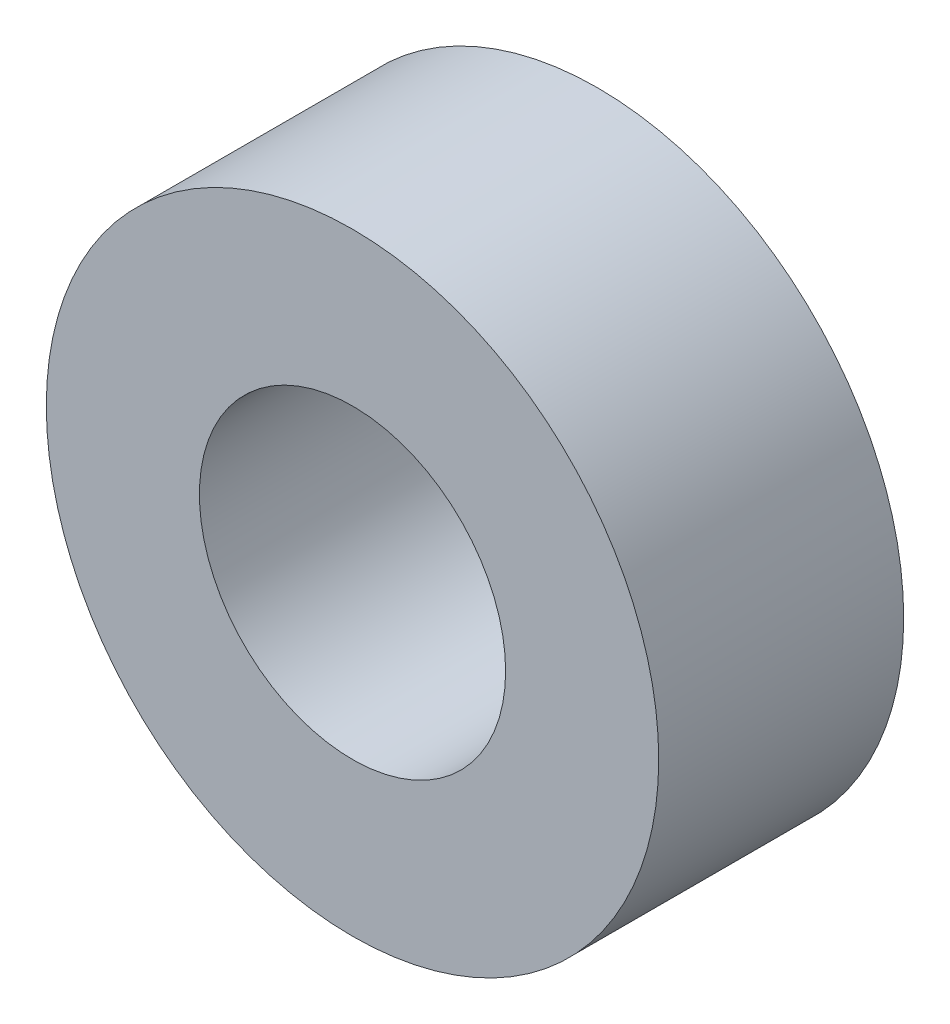
from build123d import *

# Parameters (mm, degrees)
SKETCH1_R           = 5
SKETCH1_R_2         = 2.5
BOSS_EXTRUDE1_DEPTH = 2


with BuildPart() as part:
    # Sketch1 → Boss-Extrude1 (new, symmetric)
    with BuildSketch(Plane.XY):
        Circle(SKETCH1_R)
        Circle(SKETCH1_R_2, mode=Mode.SUBTRACT)
    extrude(amount=BOSS_EXTRUDE1_DEPTH, both=True)


solid = part.part
